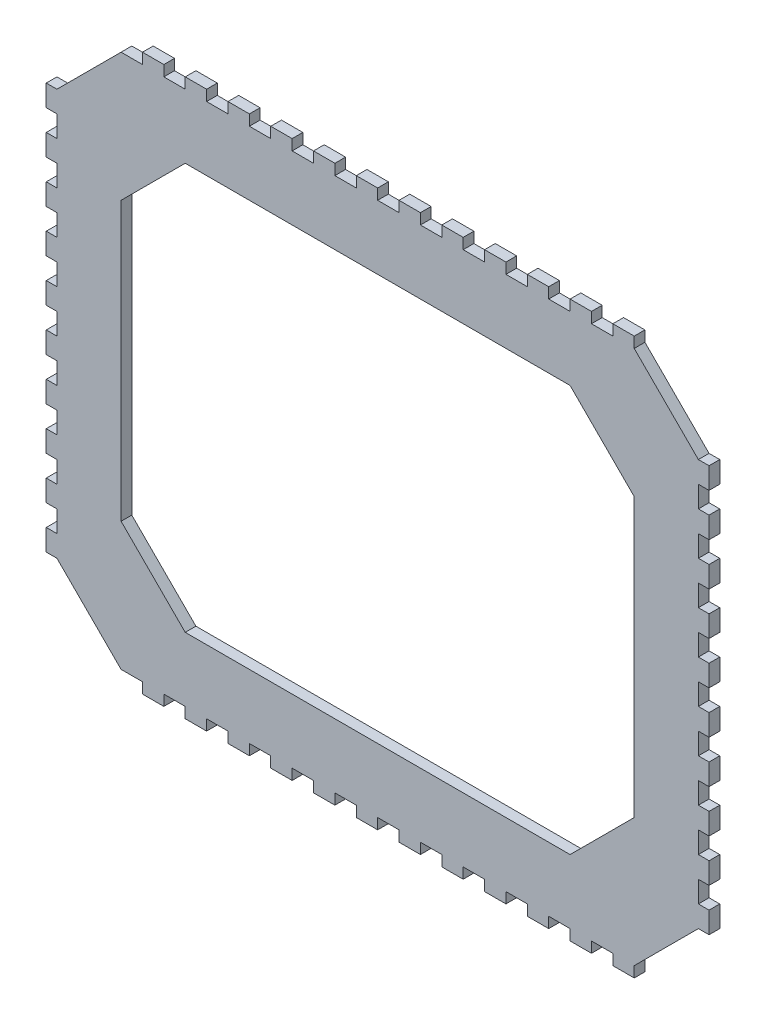
from build123d import *

# Parameters (mm, degrees)
AUFSATZ_LINEAR_AUSTRAGEN1_DEPTH = 5


with BuildPart() as part:
    # Skizze1 → Aufsatz-Linear austragen1 (new body)
    with BuildSketch(Plane.XY):
        Polygon((30, 0), (0, 30), (-5, 30), (-5, 40), (0, 40), (0, 50), (-5, 50), (-5, 60), (0, 60), (0, 70), (-5, 70), (-5, 80), (0, 80), (0, 90), (-5, 90), (-5, 100), (0, 100), (0, 110), (-5, 110), (-5, 120), (0, 120), (0, 130), (-5, 130), (-5, 140), (0, 140), (0, 150), (-5, 150), (-5, 160), (0, 160), (0, 170), (-5, 170), (-5, 180), (0, 180), (0, 190), (-5, 190), (-5, 200), (0, 200), (0, 210), (-5, 210), (-5, 220), (0, 220), (30, 250), (40, 250), (40, 255), (50, 255), (50, 250), (60, 250), (60, 255), (70, 255), (70, 250), (80, 250), (80, 255), (90, 255), (90, 250), (100, 250), (100, 255), (110, 255), (110, 250), (120, 250), (120, 255), (130, 255), (130, 250), (140, 250), (140, 255), (150, 255), (150, 250), (160, 250), (160, 255), (170, 255), (170, 250), (180, 250), (180, 255), (190, 255), (190, 250), (200, 250), (200, 255), (210, 255), (210, 250), (220, 250), (220, 255), (230, 255), (230, 250), (240, 250), (240, 255), (250, 255), (250, 250), (260, 250), (260, 255), (270, 255), (270, 250), (300, 220), (305, 220), (305, 210), (300, 210), (300, 200), (305, 200), (305, 190), (300, 190), (300, 180), (305, 180), (305, 170), (300, 170), (300, 160), (305, 160), (305, 150), (300, 150), (300, 140), (305, 140), (305, 130), (300, 130), (300, 120), (305, 120), (305, 110), (300, 110), (300, 100), (305, 100), (305, 90), (300, 90), (300, 80), (305, 80), (305, 70), (300, 70), (300, 60), (305, 60), (305, 50), (300, 50), (300, 40), (305, 40), (305, 30), (300, 30), (270, 0), (270, -5), (260, -5), (260, 0), (250, 0), (250, -5), (240, -5), (240, 0), (230, 0), (230, -5), (220, -5), (220, 0), (210, 0), (210, -5), (200, -5), (200, 0), (190, 0), (190, -5), (180, -5), (180, 0), (170, 0), (170, -5), (160, -5), (160, 0), (150, 0), (150, -5), (140, -5), (140, 0), (130, 0), (130, -5), (120, -5), (120, 0), (110, 0), (110, -5), (100, -5), (100, 0), (90, 0), (90, -5), (80, -5), (80, 0), (70, 0), (70, -5), (60, -5), (60, 0), (50, 0), (50, -5), (40, -5), (40, 0), align=None)
        Polygon((30, 190), (60, 220), (240, 220), (270, 190), (270, 60), (240, 30), (60, 30), (30, 60), align=None, mode=Mode.SUBTRACT)
    extrude(amount=AUFSATZ_LINEAR_AUSTRAGEN1_DEPTH)


solid = part.part
